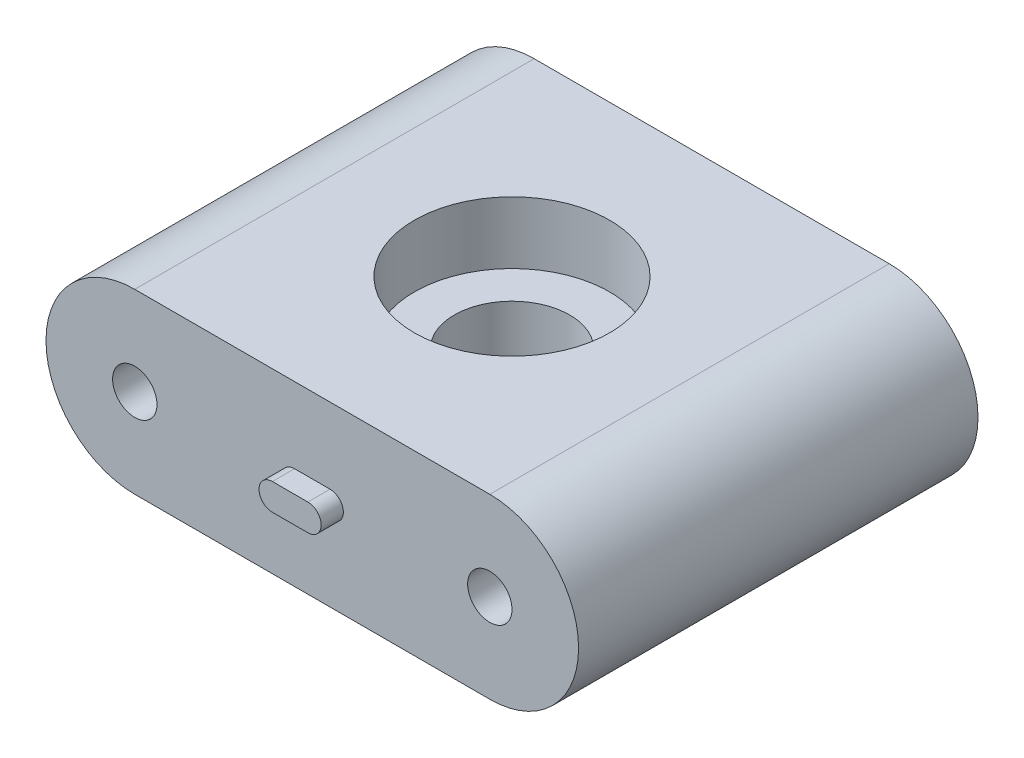
from build123d import *

# Parameters (mm, degrees)
SKETCH1_R                                   = 0.5
BOSS_EXTRUDE1_DEPTH                         = 4.5
BOSS_EXTRUDE2_DEPTH                         = 5
CBORE_FOR_M2_CHEESE_HEAD_SCREW1_D           = 2.6
CBORE_FOR_M2_CHEESE_HEAD_SCREW1_CBORE_D     = 4.4
CBORE_FOR_M2_CHEESE_HEAD_SCREW1_CBORE_DEPTH = 1.4


with BuildPart() as part:
    # Sketch1 → Boss-Extrude1 (new, symmetric)
    with BuildSketch(Plane.XY):
        with BuildLine():
            Line((-4, 2), (4, 2))
            ThreePointArc((4, 2), (6, 0), (4, -2))
            Line((4, -2), (-4, -2))
            ThreePointArc((-4, -2), (-6, 0), (-4, 2))
        make_face()
        with Locations((-4, 0)):
            Circle(SKETCH1_R, mode=Mode.SUBTRACT)
        with Locations((4, 0)):
            Circle(SKETCH1_R, mode=Mode.SUBTRACT)
        with BuildLine():
            Line((-0.4, 0.3), (0.4, 0.3))
            ThreePointArc((0.4, 0.3), (0.7, 0), (0.4, -0.3))
            Line((0.4, -0.3), (-0.4, -0.3))
            ThreePointArc((-0.4, -0.3), (-0.7, 0), (-0.4, 0.3))
        make_face(mode=Mode.SUBTRACT)
    extrude(amount=BOSS_EXTRUDE1_DEPTH, both=True)

    # Sketch1<2> → Boss-Extrude2 (add, symmetric)
    with BuildSketch(Plane.XY):
        with BuildLine():
            Line((-0.4, 0.3), (0.4, 0.3))
            ThreePointArc((0.4, 0.3), (0.7, 0), (0.4, -0.3))
            Line((0.4, -0.3), (-0.4, -0.3))
            ThreePointArc((-0.4, -0.3), (-0.7, 0), (-0.4, 0.3))
        make_face()
    extrude(amount=BOSS_EXTRUDE2_DEPTH, both=True)

    # CBORE for M2 Cheese Head Screw1 (through all)
    with Locations(Plane(origin=(0, 2, 0), x_dir=(1, 0, 0), z_dir=(0, 1, 0))):
        with Locations((0, 0)):
            CounterBoreHole(CBORE_FOR_M2_CHEESE_HEAD_SCREW1_D / 2, CBORE_FOR_M2_CHEESE_HEAD_SCREW1_CBORE_D / 2, CBORE_FOR_M2_CHEESE_HEAD_SCREW1_CBORE_DEPTH)


solid = part.part
